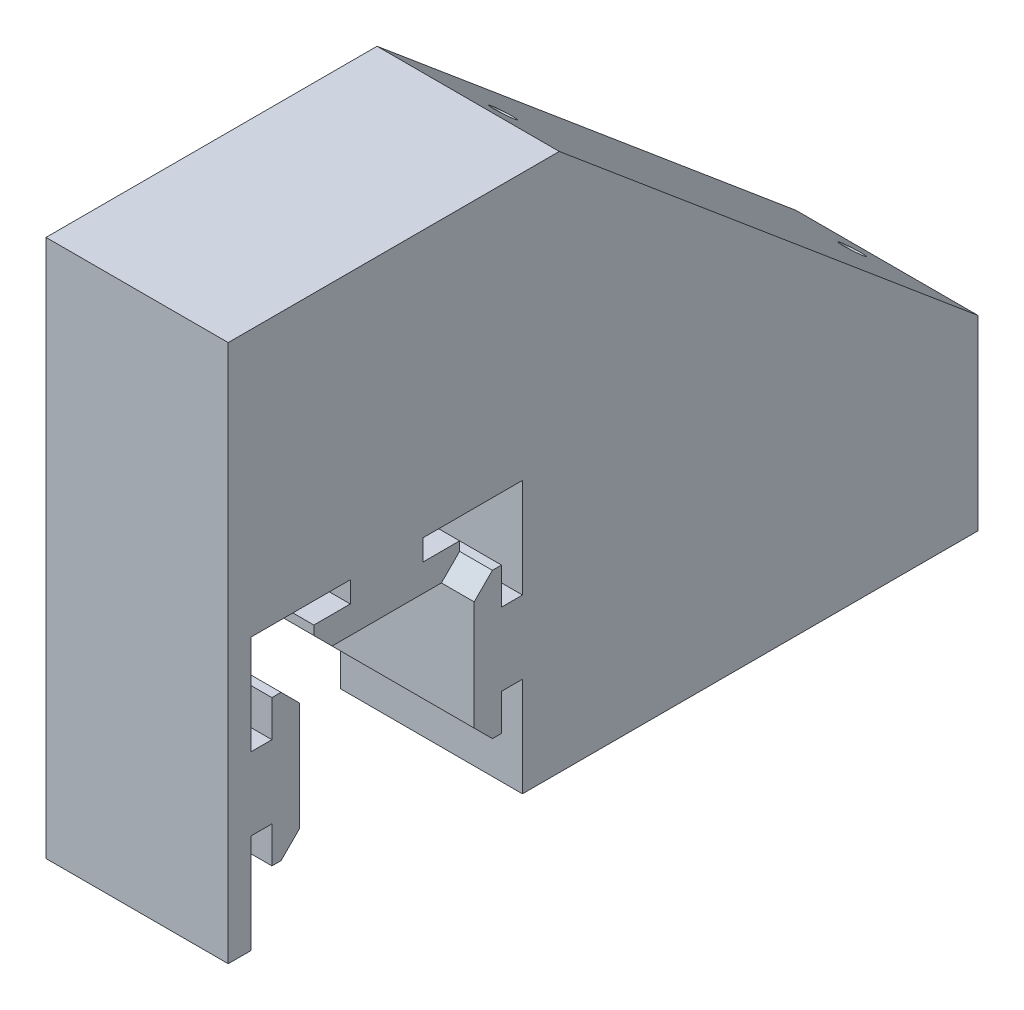
from build123d import *

# Parameters (mm, degrees)
BOSS_EXTRU_1_DEPTH                            = 20
TROU_POUR_TARAUDAGE_POUR_TROU_TARAUD_M3_D     = 2.5
TROU_POUR_TARAUDAGE_POUR_TROU_TARAUD_M3_DEPTH = 6
TROU_POUR_TARAUDAGE_POUR_TROU_TARAUD_M3_TIP   = 0.751075774


with BuildPart() as part:
    # Esquisse1 → Boss.-Extru.1 (new body)
    with BuildSketch(Plane(origin=(0, 0, 0), x_dir=(0, 0, -1), z_dir=(1, 0, 0))):
        Polygon((4.8, 18.9), (2.5, 18.9), (2.5, 29.8), (13.4, 29.8), (13.4, 27.5), (9.4, 27.5), (9.4, 26.5), (11.4, 24.5), (23.4, 24.5), (25.4, 26.5), (25.4, 27.5), (21.4, 27.5), (21.4, 29.8), (32.3, 29.8), (32.3, 18.9), (30, 18.9), (30, 22.9), (29, 22.9), (27, 20.9), (27, 8.9), (29, 6.9), (30, 6.9), (30, 10.9), (32.3, 10.9), (32.3, 0), (82.3, 0), (82.3, 20.480200674), (36.337333413, 59.047457256), (0, 59.047457256), (0, 0), (2.5, 0), (2.5, 10.9), (4.8, 10.9), (4.8, 6.9), (5.8, 6.9), (7.8, 8.9), (7.8, 20.9), (5.8, 22.9), (4.8, 22.9), align=None)
    extrude(amount=BOSS_EXTRU_1_DEPTH)

    # Trou pour taraudage pour trou taraudé M3x0.51
    with Locations(Plane(origin=(0, 52.543114136, -44.088907693), x_dir=(1, 0, 0), z_dir=(0, 0.7660444431189818, -0.6427876096865348))):
        with Locations((10, -5.118961569), (10, 44.881038431)):
            Hole(TROU_POUR_TARAUDAGE_POUR_TROU_TARAUD_M3_D / 2, depth=TROU_POUR_TARAUDAGE_POUR_TROU_TARAUD_M3_DEPTH)
            with Locations((0, 0, -(TROU_POUR_TARAUDAGE_POUR_TROU_TARAUD_M3_DEPTH + TROU_POUR_TARAUDAGE_POUR_TROU_TARAUD_M3_TIP / 2))):  # 118° drill point
                Cone(0, TROU_POUR_TARAUDAGE_POUR_TROU_TARAUD_M3_D / 2, TROU_POUR_TARAUDAGE_POUR_TROU_TARAUD_M3_TIP, mode=Mode.SUBTRACT)


solid = part.part
